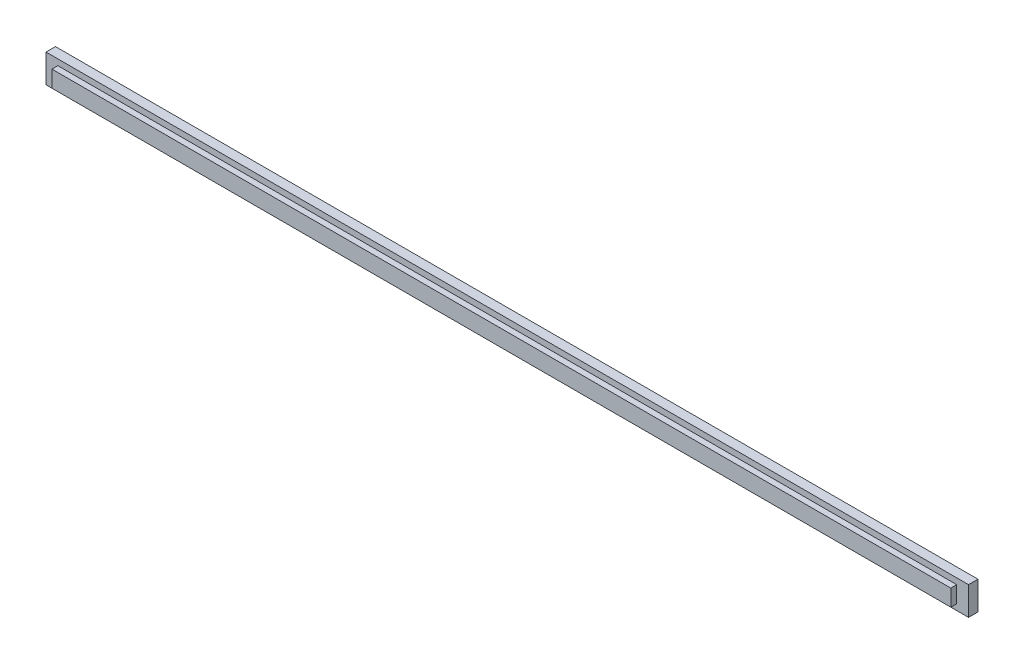
from build123d import *

# Parameters (mm, degrees)
ESQUISSE1_W              = 390
ESQUISSE1_H              = 12
PROFIL_BANDEAU_LED_DEPTH = 4
DIFFUSEUR_LED_START      = 4
ESQUISSE2_W              = 380
ESQUISSE2_H              = 7
DIFFUSEUR_LED_DEPTH      = 2.5


with BuildPart() as part:
    # Esquisse1 → Profil_bandeau_LED (new body)
    with BuildSketch(Plane.XY):
        Rectangle(ESQUISSE1_W, ESQUISSE1_H)
    extrude(amount=PROFIL_BANDEAU_LED_DEPTH)

    # Esquisse2 → Diffuseur_LED (add)
    with BuildSketch(Plane.XY.offset(DIFFUSEUR_LED_START)):
        Rectangle(ESQUISSE2_W, ESQUISSE2_H)
    extrude(amount=DIFFUSEUR_LED_DEPTH)


solid = part.part
